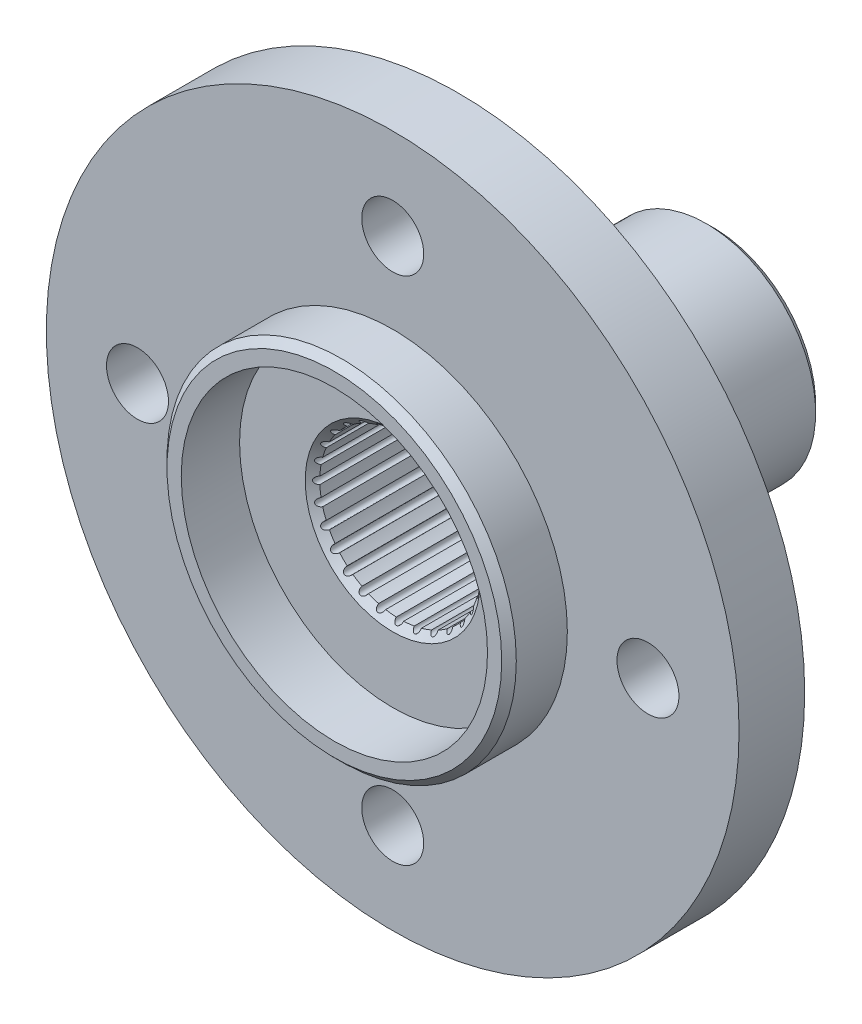
from build123d import *

# Parameters (mm, degrees)
SKETCH1_R           = 47.5
BOSS_EXTRUDE1_DEPTH = 9
SKETCH2_R           = 20
BOSS_EXTRUDE2_DEPTH = 6.2
SKETCH3_R           = 15
BOSS_EXTRUDE3_DEPTH = 28.8
SKETCH6_R           = 11
CUT_EXTRUDE2_DEPTH  = 25
CHAMFER2_SIZE       = 1
CUT_EXTRUDE5_REACH  = 82.303
SKETCH9_R           = 4.25
CHAMFER3_SIZE       = 1
SKETCH12_R          = 23.95
BOSS_EXTRUDE4_DEPTH = 8
SKETCH13_R          = 21
CUT_EXTRUDE6_DEPTH  = 8
CHAMFER4_SIZE       = 1
SKETCH8_R           = 0.5
CUT_EXTRUDE4_DEPTH  = 25
SKETCH14_R          = 11
CUT_EXTRUDE7_DEPTH  = 73.398204398
CHAMFER5_SIZE       = 1
SKETCH15_R          = 0.5
CUT_EXTRUDE8_DEPTH  = 85.949985285
FILLET1_R           = 2


with BuildPart() as part:
    # Sketch1 → Boss-Extrude1 (new body)
    with BuildSketch(Plane.XY):
        Circle(SKETCH1_R)
    extrude(amount=BOSS_EXTRUDE1_DEPTH)

    # Sketch2 → Boss-Extrude2 (add)
    with BuildSketch(Plane(origin=(0, 0, 0), x_dir=(-1, 0, 0), z_dir=(0, 0, -1))):
        with Locations(Location((0, 0, 0), (0, 0, 180))):
            Circle(SKETCH2_R)
    extrude(amount=BOSS_EXTRUDE2_DEPTH)

    # Sketch3 → Boss-Extrude3 (add)
    with BuildSketch(Plane(origin=(0, 0, -6.2), x_dir=(-1, 0, 0), z_dir=(0, 0, -1))):
        Circle(SKETCH3_R)
    extrude(amount=BOSS_EXTRUDE3_DEPTH)

    # Sketch6 → Cut-Extrude2 (cut)
    with BuildSketch(Plane(origin=(0, 0, -35), x_dir=(-1, 0, 0), z_dir=(0, 0, -1))):
        Circle(SKETCH6_R)
    extrude(amount=-CUT_EXTRUDE2_DEPTH, mode=Mode.SUBTRACT)

    # Chamfer2
    chamfer2_edges = [part.edges().sort_by_distance(p)[0] for p in [
        (11, 0, -35),
    ]]
    chamfer(chamfer2_edges, length=CHAMFER2_SIZE)

    # Sketch9 → Cut-Extrude5 (cut, up to next)
    with BuildSketch(Plane.XY.offset(9), mode=Mode.PRIVATE) as cut_extrude5_sk1:
        with Locations((0, 35)):
            Circle(SKETCH9_R)
    cut_extrude5_tool1 = extrude(cut_extrude5_sk1.sketch, amount=-CUT_EXTRUDE5_REACH, mode=Mode.PRIVATE) & part.part
    # Sketch9 → Cut-Extrude5 (cut, up to next)
    with BuildSketch(Plane.XY.offset(9), mode=Mode.PRIVATE) as cut_extrude5_sk2:
        with Locations((35, 0)):
            Circle(SKETCH9_R)
    cut_extrude5_tool2 = extrude(cut_extrude5_sk2.sketch, amount=-CUT_EXTRUDE5_REACH, mode=Mode.PRIVATE) & part.part
    # Sketch9 → Cut-Extrude5 (cut, up to next)
    with BuildSketch(Plane.XY.offset(9), mode=Mode.PRIVATE) as cut_extrude5_sk3:
        with Locations((0, -35)):
            Circle(SKETCH9_R)
    cut_extrude5_tool3 = extrude(cut_extrude5_sk3.sketch, amount=-CUT_EXTRUDE5_REACH, mode=Mode.PRIVATE) & part.part
    # Sketch9 → Cut-Extrude5 (cut, up to next)
    with BuildSketch(Plane.XY.offset(9), mode=Mode.PRIVATE) as cut_extrude5_sk4:
        with Locations((-35, 0)):
            Circle(SKETCH9_R)
    cut_extrude5_tool4 = extrude(cut_extrude5_sk4.sketch, amount=-CUT_EXTRUDE5_REACH, mode=Mode.PRIVATE) & part.part
    add(cut_extrude5_tool1.solids().sort_by_distance((0, 35, 9))[0], mode=Mode.SUBTRACT)
    add(cut_extrude5_tool2.solids().sort_by_distance((35, 0, 9))[0], mode=Mode.SUBTRACT)
    add(cut_extrude5_tool3.solids().sort_by_distance((0, -35, 9))[0], mode=Mode.SUBTRACT)
    add(cut_extrude5_tool4.solids().sort_by_distance((-35, 0, 9))[0], mode=Mode.SUBTRACT)

    # Chamfer3
    chamfer3_edges = [part.edges().sort_by_distance(p)[0] for p in [
        (15, 0, -35),
    ]]
    chamfer(chamfer3_edges, length=CHAMFER3_SIZE)

    # Sketch12 → Boss-Extrude4 (add)
    with BuildSketch(Plane.XY.offset(9)):
        Circle(SKETCH12_R)
    extrude(amount=BOSS_EXTRUDE4_DEPTH)

    # Sketch13 → Cut-Extrude6 (cut)
    with BuildSketch(Plane.XY.offset(17)):
        Circle(SKETCH13_R)
    extrude(amount=-CUT_EXTRUDE6_DEPTH, mode=Mode.SUBTRACT)

    # Chamfer4
    chamfer4_edges = [part.edges().sort_by_distance(p)[0] for p in [
        (-23.95, 0, 17),
    ]]
    chamfer(chamfer4_edges, length=CHAMFER4_SIZE)

    # Sketch8 → Cut-Extrude4 (cut)
    with BuildSketch(Plane(origin=(0, 0, -35), x_dir=(-1, 0, 0), z_dir=(0, 0, -1))):
        with Locations((0, 11)):
            Circle(SKETCH8_R)
        with Locations((2.447730274, 10.724207034)):
            Circle(SKETCH8_R)
        with Locations((4.77272113, 9.910657547)):
            Circle(SKETCH8_R)
        with Locations((6.85838782, 8.600146307)):
            Circle(SKETCH8_R)
        with Locations((8.600146307, 6.85838782)):
            Circle(SKETCH8_R)
        with Locations((9.910657547, 4.77272113)):
            Circle(SKETCH8_R)
        with Locations((10.724207034, 2.447730274)):
            Circle(SKETCH8_R)
        with Locations((11, 0)):
            Circle(SKETCH8_R)
        with Locations((10.724207034, -2.447730274)):
            Circle(SKETCH8_R)
        with Locations((9.910657547, -4.77272113)):
            Circle(SKETCH8_R)
        with Locations((8.600146307, -6.85838782)):
            Circle(SKETCH8_R)
        with Locations((6.85838782, -8.600146307)):
            Circle(SKETCH8_R)
        with Locations((4.77272113, -9.910657547)):
            Circle(SKETCH8_R)
        with Locations((2.447730274, -10.724207034)):
            Circle(SKETCH8_R)
        with Locations((0, -11)):
            Circle(SKETCH8_R)
        with Locations((-2.447730274, -10.724207034)):
            Circle(SKETCH8_R)
        with Locations((-4.77272113, -9.910657547)):
            Circle(SKETCH8_R)
        with Locations((-6.85838782, -8.600146307)):
            Circle(SKETCH8_R)
        with Locations((-8.600146307, -6.85838782)):
            Circle(SKETCH8_R)
        with Locations((-9.910657547, -4.77272113)):
            Circle(SKETCH8_R)
        with Locations((-10.724207034, -2.447730274)):
            Circle(SKETCH8_R)
        with Locations((-11, 0)):
            Circle(SKETCH8_R)
        with Locations((-10.724207034, 2.447730274)):
            Circle(SKETCH8_R)
        with Locations((-9.910657547, 4.77272113)):
            Circle(SKETCH8_R)
        with Locations((-8.600146307, 6.85838782)):
            Circle(SKETCH8_R)
        with Locations((-6.85838782, 8.600146307)):
            Circle(SKETCH8_R)
        with Locations((-4.77272113, 9.910657547)):
            Circle(SKETCH8_R)
        with Locations((-2.447730274, 10.724207034)):
            Circle(SKETCH8_R)
    extrude(amount=-CUT_EXTRUDE4_DEPTH, mode=Mode.SUBTRACT)

    # Sketch14 → Cut-Extrude7 (cut, through all)
    with BuildSketch(Plane(origin=(0, 0, -10), x_dir=(-1, 0, 0), z_dir=(0, 0, -1))):
        with Locations(Location((0, 0, 0), (0, 0, 357.39542213))):
            Circle(SKETCH14_R)
    extrude(amount=-CUT_EXTRUDE7_DEPTH, mode=Mode.SUBTRACT)

    # Chamfer5
    chamfer5_edges = [part.edges().sort_by_distance(p)[0] for p in [
        (10.988636364, 0.499870851, 9),
    ]]
    chamfer(chamfer5_edges, length=CHAMFER5_SIZE)

    # Sketch15 → Cut-Extrude8 (cut, through all)
    with BuildSketch(Plane(origin=(0, 0, -35), x_dir=(-1, 0, 0), z_dir=(0, 0, -1))):
        with Locations((8.600146307, 6.85838782)):
            Circle(SKETCH15_R)
        with Locations((6.85838782, 8.600146307)):
            Circle(SKETCH15_R)
        with Locations((4.77272113, 9.910657547)):
            Circle(SKETCH15_R)
        with Locations((2.447730274, 10.724207034)):
            Circle(SKETCH15_R)
        with Locations((0, 11)):
            Circle(SKETCH15_R)
        with Locations((4.77272113, -9.910657547)):
            Circle(SKETCH15_R)
        with Locations((6.85838782, -8.600146307)):
            Circle(SKETCH15_R)
        with Locations((8.600146307, -6.85838782)):
            Circle(SKETCH15_R)
        with Locations((9.910657547, -4.77272113)):
            Circle(SKETCH15_R)
        with Locations((10.724207034, -2.447730274)):
            Circle(SKETCH15_R)
        with Locations((11, 0)):
            Circle(SKETCH15_R)
        with Locations((10.724207034, 2.447730274)):
            Circle(SKETCH15_R)
        with Locations((9.910657547, 4.77272113)):
            Circle(SKETCH15_R)
        with Locations((-10.724207034, -2.447730274)):
            Circle(SKETCH15_R)
        with Locations((-9.910657547, -4.77272113)):
            Circle(SKETCH15_R)
        with Locations((-8.600146307, -6.85838782)):
            Circle(SKETCH15_R)
        with Locations((-6.85838782, -8.600146307)):
            Circle(SKETCH15_R)
        with Locations((-4.77272113, -9.910657547)):
            Circle(SKETCH15_R)
        with Locations((-2.447730274, -10.724207034)):
            Circle(SKETCH15_R)
        with Locations((0, -11)):
            Circle(SKETCH15_R)
        with Locations((2.447730274, -10.724207034)):
            Circle(SKETCH15_R)
        with Locations((-2.447730274, 10.724207034)):
            Circle(SKETCH15_R)
        with Locations((-4.77272113, 9.910657547)):
            Circle(SKETCH15_R)
        with Locations((-6.85838782, 8.600146307)):
            Circle(SKETCH15_R)
        with Locations((-8.600146307, 6.85838782)):
            Circle(SKETCH15_R)
        with Locations((-9.910657547, 4.77272113)):
            Circle(SKETCH15_R)
        with Locations((-10.724207034, 2.447730274)):
            Circle(SKETCH15_R)
        with Locations((-11, 0)):
            Circle(SKETCH15_R)
    extrude(amount=-CUT_EXTRUDE8_DEPTH, mode=Mode.SUBTRACT)

    # Fillet1
    fillet1_edges = [part.edges().sort_by_distance(p)[0] for p in [
        (-20, 0, 0),
        (-20, 0, -6.2),
    ]]
    fillet(fillet1_edges, radius=FILLET1_R)


solid = part.part
